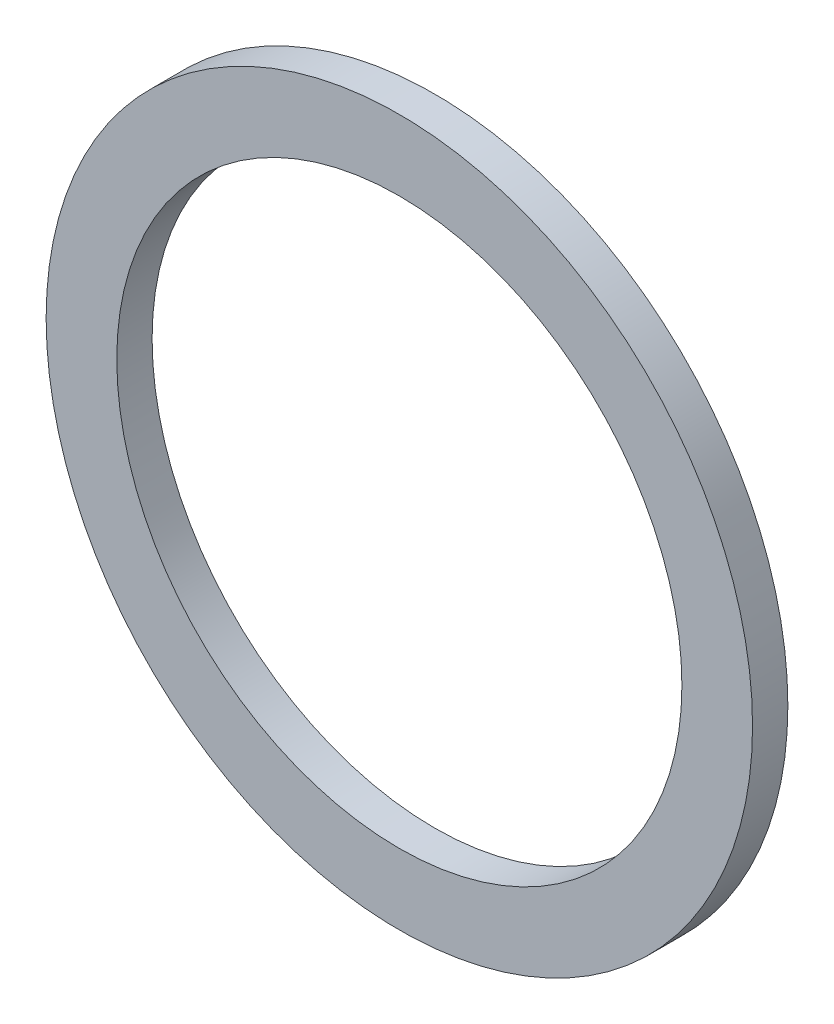
from build123d import *

# Parameters (mm, degrees)
SKETCH1_R               = 10
BOSS_EXTRUDE1_DEPTH     = 1
CUT_EXTRUDE1_DEPTH      = 15.177446879
CUT_EXTRUDE1_DEPTH_BACK = 15.177446879
SKETCH2_R               = 8


with BuildPart() as part:
    # Sketch1 → Boss-Extrude1 (new body)
    with BuildSketch(Plane.XY):
        Circle(SKETCH1_R)
    extrude(amount=BOSS_EXTRUDE1_DEPTH)

    # Sketch2 → Cut-Extrude1 (cut, two sides: drawn at the far end of the back side and taken through both)
    with BuildSketch(Plane(origin=(0, 0, 0), x_dir=(-1, 0, 0), z_dir=(0, 0, -1)).offset(-CUT_EXTRUDE1_DEPTH_BACK)):
        Circle(SKETCH2_R)
    extrude(amount=CUT_EXTRUDE1_DEPTH + CUT_EXTRUDE1_DEPTH_BACK, mode=Mode.SUBTRACT)


solid = part.part
